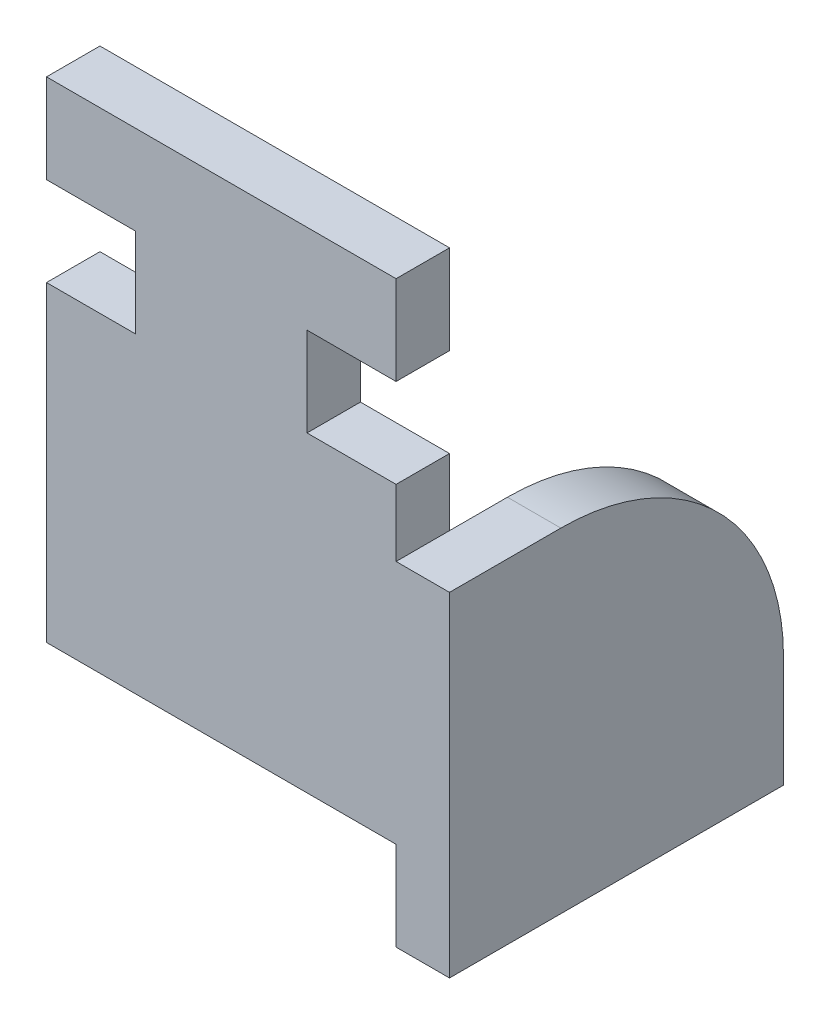
from build123d import *

# Parameters (mm, degrees)
BOSS_EXTRUDE1_DEPTH = 0.24
SKETCH2_W           = 1.5
SKETCH2_H           = 1.5
BOSS_EXTRUDE2_DEPTH = 0.24
FILLET1_R           = 1


with BuildPart() as part:
    # Sketch1 → Boss-Extrude1 (new body)
    with BuildSketch(Plane.XY):
        Polygon((0, 0), (0, 1.4), (0.4, 1.4), (0.4, 1.8), (0, 1.8), (0, 2.2), (1.57, 2.2), (1.57, 1.8), (1.17, 1.8), (1.17, 1.4), (1.57, 1.4), (1.57, 0), align=None)
    extrude(amount=BOSS_EXTRUDE1_DEPTH)

    # Sketch2 → Boss-Extrude2 (add)
    with BuildSketch(Plane(origin=(1.57, 0, 0), x_dir=(0, 0, -1), z_dir=(1, 0, 0))):
        with Locations((0.51, 0.35)):
            Rectangle(SKETCH2_W, SKETCH2_H)
    extrude(amount=BOSS_EXTRUDE2_DEPTH)

    # Fillet1
    fillet1_edges = [part.edges().sort_by_distance(p)[0] for p in [
        (1.69, 1.1, -1.26),
    ]]
    fillet(fillet1_edges, radius=FILLET1_R)


solid = part.part
